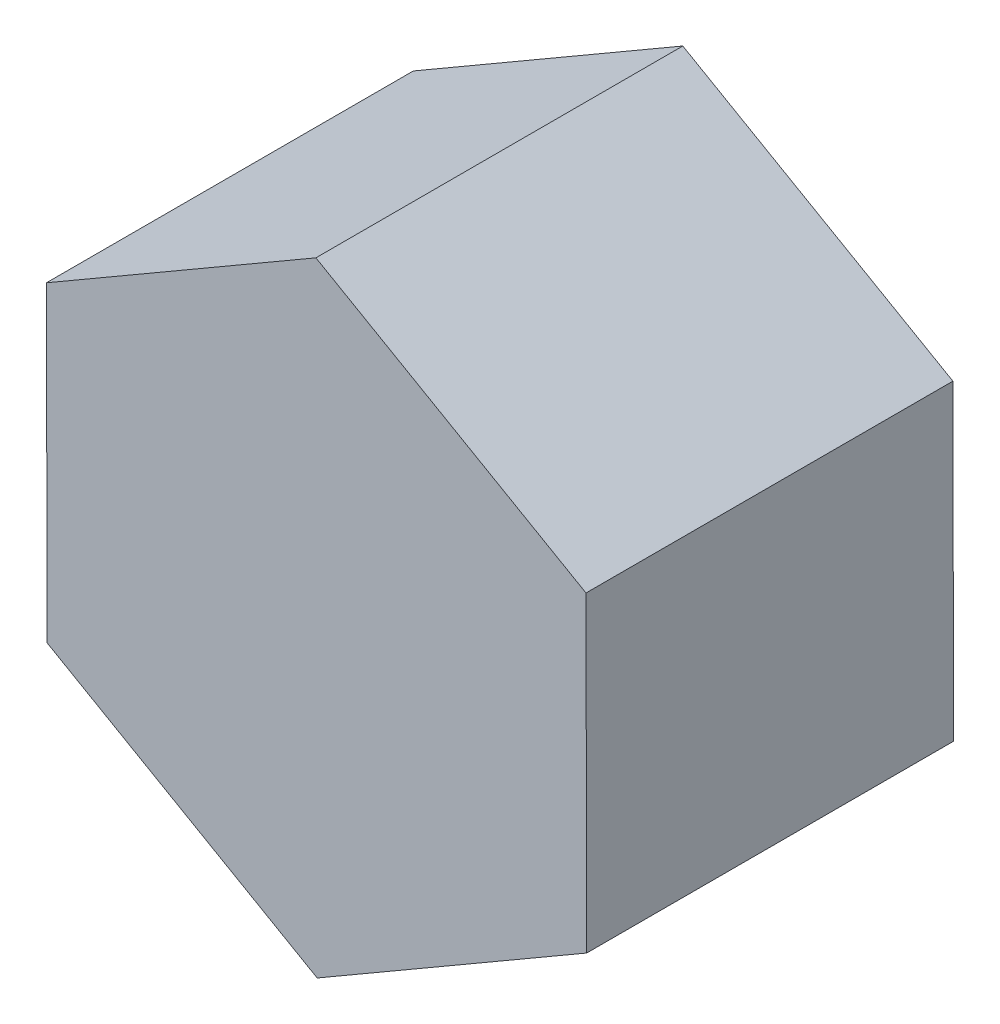
from build123d import *

# Parameters (mm, degrees)
BOSS_EXTRUDE1_DEPTH = 8.636


with BuildPart() as part:
    # Sketch1 → Boss-Extrude1 (new body)
    with BuildSketch(Plane.XY):
        Polygon((6.357687628, -3.65282649), (6.34228435, 3.67950575), (-0.015403278, 7.33233224), (-6.357687628, 3.65282649), (-6.34228435, -3.67950575), (0.015403278, -7.33233224), align=None)
    extrude(amount=BOSS_EXTRUDE1_DEPTH)


solid = part.part
